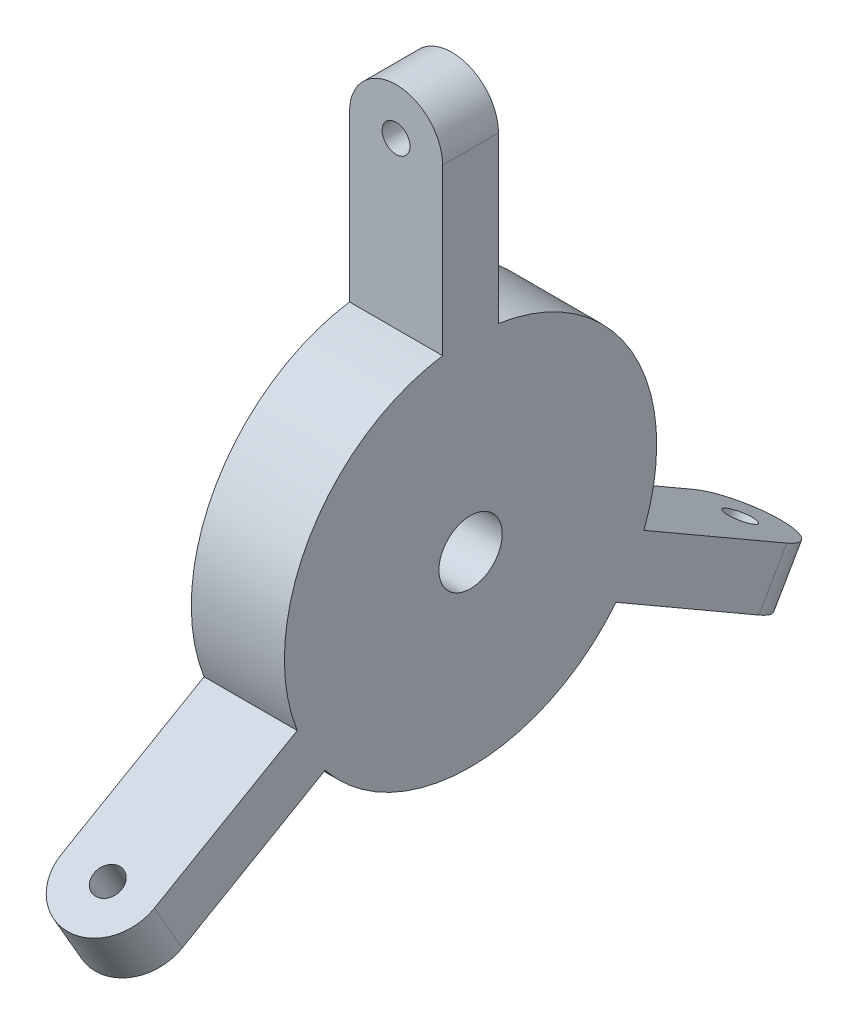
from build123d import *

# Parameters (mm, degrees)
BOSS_EXTRU_1_DEPTH           = 5
BOSS_EXTRU_1_DEPTH_BACK      = 5
TROU_TARAUD_M81_D            = 6.8
ESQUISSE5_R                  = 1.5
ENL_V_MAT_EXTRU_1_DEPTH      = 60.476400504
R_P_TITION_CIRCULAIRE1_COUNT = 3


with BuildPart() as part:
    # Esquisse1 → Boss.-Extru.1 (new, two sides: drawn at the far end of the back side and taken through both)
    with BuildSketch(Plane(origin=(0, 0, 0), x_dir=(0, 0, -1), z_dir=(1, 0, 0)).offset(-BOSS_EXTRU_1_DEPTH_BACK)):
        with BuildLine():
            Line((-3, 42.5), (3, 42.5))
            Line((3, 42.5), (3, 19.773719933))
            ThreePointArc((3, 19.773719933), (17.320508076, 10), (18.62454379, -7.288783755))
            Line((18.62454379, -7.288783755), (38.306079661, -18.651923789))
            Line((38.306079661, -18.651923789), (35.306079661, -23.848076211))
            Line((35.306079661, -23.848076211), (15.62454379, -12.484936178))
            ThreePointArc((15.62454379, -12.484936178), (0, -20), (-15.62454379, -12.484936178))
            Line((-15.62454379, -12.484936178), (-35.306079661, -23.848076211))
            Line((-35.306079661, -23.848076211), (-38.306079661, -18.651923789))
            Line((-38.306079661, -18.651923789), (-18.62454379, -7.288783755))
            ThreePointArc((-18.62454379, -7.288783755), (-17.320508076, 10), (-3, 19.773719933))
            Line((-3, 19.773719933), (-3, 42.5))
        make_face()
    extrude(amount=BOSS_EXTRU_1_DEPTH + BOSS_EXTRU_1_DEPTH_BACK)

    # Trou taraudé M81 (through all)
    with Locations(Plane(origin=(5, 0, 0), x_dir=(0, 0, -1), z_dir=(1, 0, 0))):
        with Locations((0, 0)):
            Hole(TROU_TARAUD_M81_D / 2)

    # Esquisse5 → Enlèv. mat.-Extru.1 (cut, through all)
    with BuildSketch(Plane.XY.offset(3)):
        with Locations((0, 37.5)):
            Circle(ESQUISSE5_R)
        with BuildLine():
            Line((-5, 19.773719933), (-5, 37.5))
            ThreePointArc((-5, 37.5), (0, 42.5), (5, 37.5))
            Line((5, 37.5), (5, 19.773719933))
            Line((5, 19.773719933), (13.62028311, 19.773719933))
            Line((13.62028311, 19.773719933), (13.62028311, 47.5))
            Line((13.62028311, 47.5), (-13.199246966, 47.5))
            Line((-13.199246966, 47.5), (-13.199246966, 19.773719933))
            Line((-13.199246966, 19.773719933), (-5, 19.773719933))
        make_face()
    enl_v_mat_extru_1 = extrude(amount=-ENL_V_MAT_EXTRU_1_DEPTH, mode=Mode.SUBTRACT)

    # Répétition circulaire1: Enlèv. mat.-Extru.1 ×3 about axis
    r_p_tition_circulaire1_axis = Axis((5, 0, 0), (1, 0, 0))
    for i in range(1, R_P_TITION_CIRCULAIRE1_COUNT):
        add(enl_v_mat_extru_1.rotate(r_p_tition_circulaire1_axis, i * 360 / R_P_TITION_CIRCULAIRE1_COUNT), mode=Mode.SUBTRACT)


solid = part.part
